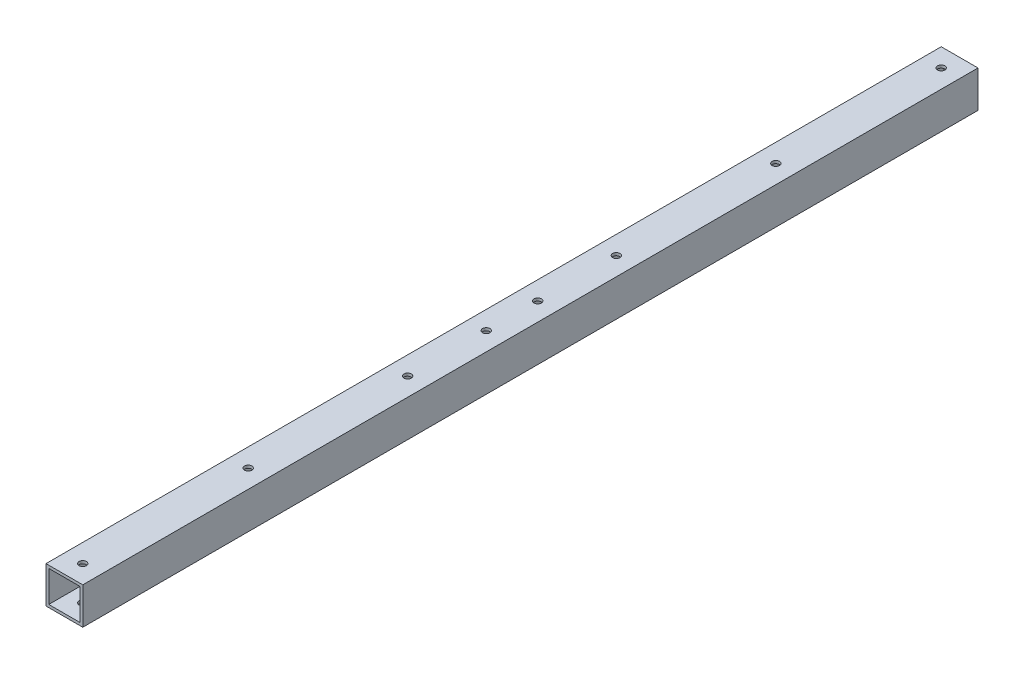
from build123d import *

# Parameters (mm, degrees)
SKETCH_1_W          = 20
SKETCH_1_H          = 20
SKETCH_1_W_2        = 17
SKETCH_1_H_2        = 17
EXTRUDE_1_DEPTH     = 487
SKETCH_3_R          = 2
CUT_EXTRUDE_2_DEPTH = 20
SKETCH_4_R          = 2
CUT_EXTRUDE_3_DEPTH = 20


with BuildPart() as part:
    # 草图1 → 凸台-拉伸1 (new body)
    with BuildSketch(Plane.XY):
        Rectangle(SKETCH_1_W, SKETCH_1_H)
        Rectangle(SKETCH_1_W_2, SKETCH_1_H_2, mode=Mode.SUBTRACT)
    extrude(amount=EXTRUDE_1_DEPTH)

    # 草图3 → 切除-拉伸2 (cut)
    with BuildSketch(Plane(origin=(0, 10, 0), x_dir=(1, 0, 0), z_dir=(0, 1, 0))):
        with Locations(Location((0, -10, 0), (0, 0, 270))):
            Circle(SKETCH_3_R)
        with Locations(Location((0, -477, 0), (0, 0, 270))):
            Circle(SKETCH_3_R)
        with Locations(Location((0, -100, 0), (0, 0, 270))):
            Circle(SKETCH_3_R)
        with Locations(Location((0, -387, 0), (0, 0, 270))):
            Circle(SKETCH_3_R)
        with Locations(Location((0, -186.75, 0), (0, 0, 270))):
            Circle(SKETCH_3_R)
        with Locations(Location((0, -300.25, 0), (0, 0, 270))):
            Circle(SKETCH_3_R)
    extrude(amount=-CUT_EXTRUDE_2_DEPTH, mode=Mode.SUBTRACT)

    # 草图4 → 切除-拉伸3 (cut)
    with BuildSketch(Plane(origin=(0, 10, 0), x_dir=(1, 0, 0), z_dir=(0, 1, 0))):
        with Locations(Location((0, -229.5, 0), (0, 0, 270))):
            Circle(SKETCH_4_R)
        with Locations(Location((0, -257.5, 0), (0, 0, 270))):
            Circle(SKETCH_4_R)
    extrude(amount=-CUT_EXTRUDE_3_DEPTH, mode=Mode.SUBTRACT)


solid = part.part
